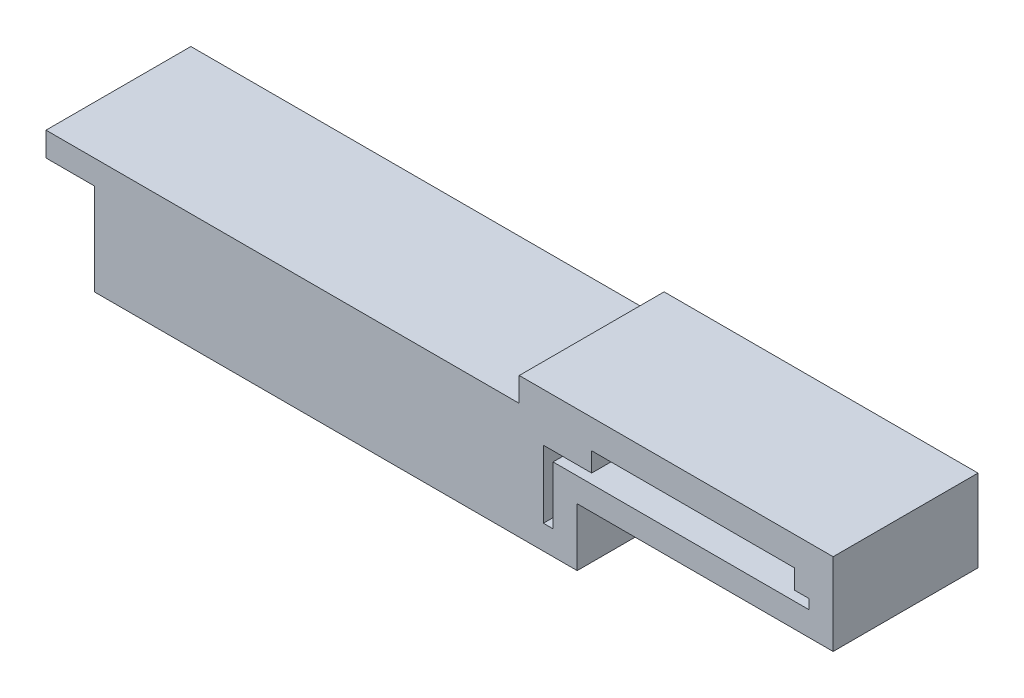
from build123d import *

# Parameters (mm, degrees)
SKETCH_1_W      = 65
SKETCH_1_H      = 5
EXTRUDE_2_DEPTH = 30
SKETCH_4_W      = 10
SKETCH_4_H      = 5
EXTRUDE_4_DEPTH = 30


with BuildPart() as part:
    # 스케치1 → 보스-돌출2 (new body)
    # profile 1 of 2: a face of its own
    with BuildSketch(Plane.XY):
        with Locations((27.5, 21.5)):
            Rectangle(SKETCH_1_W, SKETCH_1_H)
    # profile 2 of 2: a face of its own
    with BuildSketch(Plane.XY):
        Polygon((-5, 19), (-5, -5), (7, -5), (7, 7), (60, 7), (60, 19), align=None)
        Polygon((2, 0), (0, 0), (0, 14), (10, 14), (10, 18), (52, 18), (52, 14), (55, 14), (55, 12), (2, 12), align=None, mode=Mode.SUBTRACT)
    extrude(amount=EXTRUDE_2_DEPTH)

    # 스케치4 → 보스-돌출4 (add)
    with BuildSketch(Plane(origin=(0, 0, 0), x_dir=(-1, 0, 0), z_dir=(0, 0, -1))):
        Polygon((93, 19), (5, 19), (5, -5), (93, -5), (93, 14), align=None)
        with Locations((98, 16.5)):
            Rectangle(SKETCH_4_W, SKETCH_4_H)
    extrude(amount=-EXTRUDE_4_DEPTH)


solid = part.part
